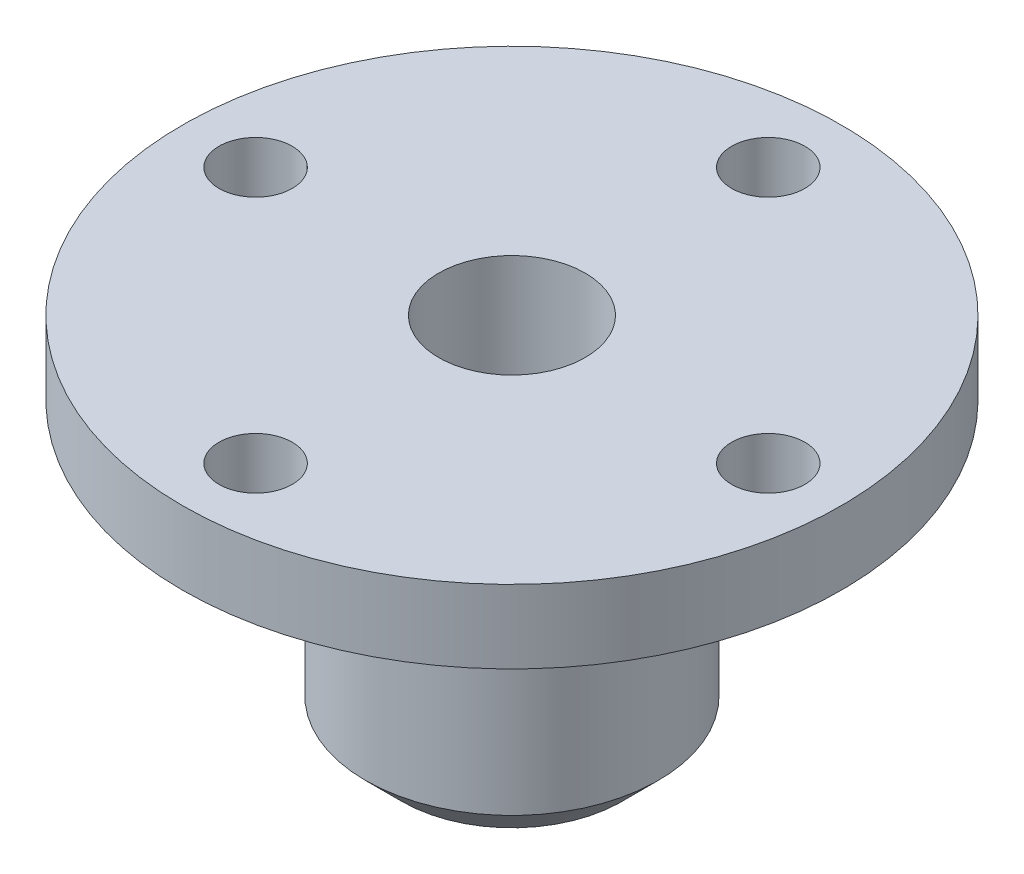
from build123d import *

# Parameters (mm, degrees)
SKICA1_R                 = 45
P_IDAT_VYSUNUT_M1_DEPTH  = 10
SKICA3_R                 = 5
ODEBRAT_VYSUNUT_M1_DEPTH = 65.420493634
KRUHOV_POLE1_COUNT       = 4
SKICA4_R                 = 20
P_IDAT_VYSUNUT_M2_DEPTH  = 50
SKICA5_R                 = 10
ODEBRAT_VYSUNUT_M2_DEPTH = 81.932070281
ZAOBLIT1_R               = 5
ZKOSEN_1_SIZE            = 5


with BuildPart() as part:
    # Skica1 → Přidat vysunutím1 (new body)
    with BuildSketch(Plane(origin=(0, 0, 0), x_dir=(1, 0, 0), z_dir=(0, 1, 0))):
        with Locations(Location((0, 0, 0), (0, 0, 270))):
            Circle(SKICA1_R)
    extrude(amount=P_IDAT_VYSUNUT_M1_DEPTH)

    # Skica3 → Odebrat vysunutím1 (cut, through all)
    with BuildSketch(Plane(origin=(0, 10, 0), x_dir=(1, 0, 0), z_dir=(0, 1, 0))):
        with Locations(Location((0, 35, 0), (0, 0, 270))):
            Circle(SKICA3_R)
    odebrat_vysunut_m1 = extrude(amount=-ODEBRAT_VYSUNUT_M1_DEPTH, mode=Mode.SUBTRACT)

    # Kruhové pole1: Odebrat vysunutím1 ×4 about axis
    kruhov_pole1_axis = Axis((0, 0, 0), (0, 1, 0))
    for i in range(1, KRUHOV_POLE1_COUNT):
        add(odebrat_vysunut_m1.rotate(kruhov_pole1_axis, i * 360 / KRUHOV_POLE1_COUNT), mode=Mode.SUBTRACT)

    # Skica4 → Přidat vysunutím2 (add)
    with BuildSketch(Plane(origin=(0, 10, 0), x_dir=(1, 0, 0), z_dir=(0, 1, 0))):
        with Locations(Location((0, 0, 0), (0, 0, 270))):
            Circle(SKICA4_R)
    extrude(amount=-P_IDAT_VYSUNUT_M2_DEPTH)

    # Skica5 → Odebrat vysunutím2 (cut, through all)
    with BuildSketch(Plane.XZ.offset(40)):
        with Locations(Location((0, 0, 0), (0, 0, 270))):
            Circle(SKICA5_R)
    extrude(amount=-ODEBRAT_VYSUNUT_M2_DEPTH, mode=Mode.SUBTRACT)

    # Zaoblit1
    zaoblit1_edges = [part.edges().sort_by_distance(p)[0] for p in [
        (0, 0, -20),
    ]]
    fillet(zaoblit1_edges, radius=ZAOBLIT1_R)

    # Zkosení1
    zkosen_1_edges = [part.edges().sort_by_distance(p)[0] for p in [
        (0, -40, -20),
    ]]
    chamfer(zkosen_1_edges, length=ZKOSEN_1_SIZE)


solid = part.part
